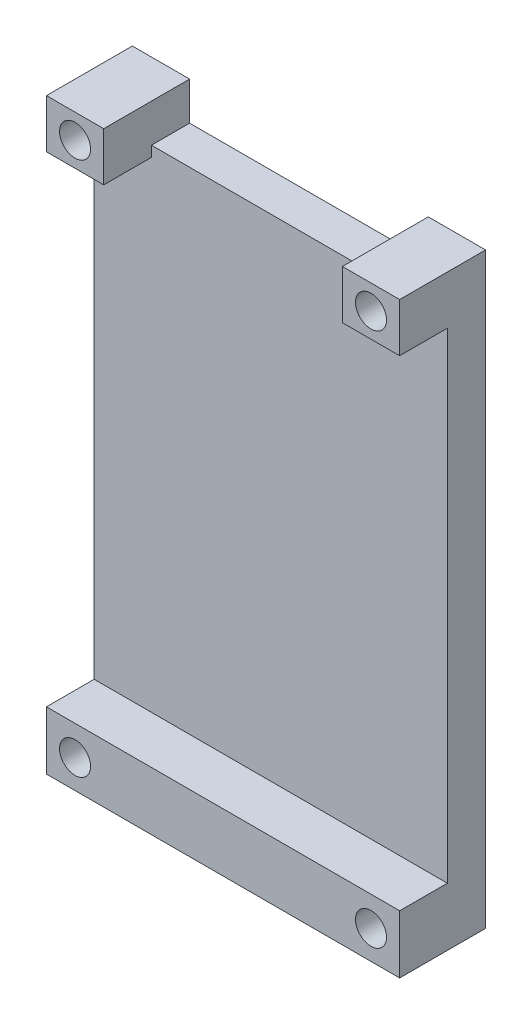
from build123d import *

# Parameters (mm, degrees)
SKETCH1_R           = 3.25
BOSS_EXTRUDE1_DEPTH = 8
SKETCH4_R           = 3.25
BOSS_EXTRUDE3_DEPTH = 10
BOSS_EXTRUDE4_DEPTH = 54
BOSS_EXTRUDE5_DEPTH = 2
BOSS_EXTRUDE6_DEPTH = 2
BOSS_EXTRUDE7_DEPTH = 2
BOSS_EXTRUDE8_DEPTH = 2
SKETCH10_W          = 74
SKETCH10_H          = 18
BOSS_EXTRUDE9_DEPTH = 2


with BuildPart() as part:
    # Sketch1 → Boss-Extrude1 (new body)
    with BuildSketch(Plane.XY):
        Polygon((-27, 52.55), (-27, 60.55), (-35, 60.55), (-35, -60.55), (-27, -60.55), (-27, -52.55), (27, -52.55), (27, -60.55), (35, -60.55), (35, 60.55), (27, 60.55), (27, 52.55), align=None)
        with Locations((31, 55.45)):
            Circle(SKETCH1_R, mode=Mode.SUBTRACT)
        with Locations((-31, 55.45)):
            Circle(SKETCH1_R, mode=Mode.SUBTRACT)
        with Locations((-31, -56.55)):
            Circle(SKETCH1_R, mode=Mode.SUBTRACT)
        with Locations((31, -56.55)):
            Circle(SKETCH1_R, mode=Mode.SUBTRACT)
    extrude(amount=BOSS_EXTRUDE1_DEPTH)

    # Sketch4 → Boss-Extrude3 (add)
    # profile 1 of 4: a face of its own
    with BuildSketch(Plane.XY.offset(8)):
        Polygon((-27, 60.55), (-35, 60.55), (-35, 50.35), (-27, 50.35), (-27, 52.55), align=None)
        with Locations((-31, 55.45)):
            Circle(SKETCH4_R, mode=Mode.SUBTRACT)
    # profile 2 of 4: a face of its own
    with BuildSketch(Plane.XY.offset(8)):
        Polygon((35, 50.35), (35, 60.55), (27, 60.55), (27, 52.55), (27, 50.35), align=None)
        with Locations((31, 55.45)):
            Circle(SKETCH4_R, mode=Mode.SUBTRACT)
    # profile 3 of 4: a face of its own
    with BuildSketch(Plane.XY.offset(8)):
        Polygon((35, -60.55), (35, -50.35), (27, -50.35), (27, -52.55), (27, -60.55), align=None)
        with Locations((31, -56.55)):
            Circle(SKETCH4_R, mode=Mode.SUBTRACT)
    # profile 4 of 4: a face of its own
    with BuildSketch(Plane.XY.offset(8)):
        Polygon((-27, -50.35), (-35, -50.35), (-35, -60.55), (-27, -60.55), (-27, -52.55), align=None)
        with Locations((-31, -56.55)):
            Circle(SKETCH4_R, mode=Mode.SUBTRACT)
    extrude(amount=BOSS_EXTRUDE3_DEPTH)

    # Sketch5 → Boss-Extrude4 (add)
    with BuildSketch(Plane(origin=(-27, 0, 0), x_dir=(0, 0, -1), z_dir=(1, 0, 0))):
        Polygon((-18, -50.35), (-8, -50.35), (-8, -52.55), (0, -52.55), (0, -60.55), (-18, -60.55), align=None)
    extrude(amount=BOSS_EXTRUDE4_DEPTH)

    # Sketch6 → Boss-Extrude5 (add)
    with BuildSketch(Plane(origin=(35, 0, 0), x_dir=(0, 0, -1), z_dir=(1, 0, 0))):
        Polygon((0, -60.55), (0, 60.55), (-18, 60.55), (-18, 50.35), (-8, 50.35), (-8, -50.35), (-18, -50.35), (-18, -60.55), align=None)
    extrude(amount=BOSS_EXTRUDE5_DEPTH)

    # Sketch7 → Boss-Extrude6 (add)
    with BuildSketch(Plane.ZY.offset(-27)):
        Polygon((0, 60.55), (0, 52.55), (8, 52.55), (8, 50.35), (18, 50.35), (18, 60.55), align=None)
    extrude(amount=BOSS_EXTRUDE6_DEPTH)

    # Sketch8 → Boss-Extrude7 (add)
    with BuildSketch(Plane.ZY.offset(35)):
        Polygon((0, 60.55), (0, -60.55), (18, -60.55), (18, -50.35), (8, -50.35), (8, 50.35), (18, 50.35), (18, 60.55), align=None)
    extrude(amount=BOSS_EXTRUDE7_DEPTH)

    # Sketch9 → Boss-Extrude8 (add)
    with BuildSketch(Plane(origin=(-27, 0, 0), x_dir=(0, 0, -1), z_dir=(1, 0, 0))):
        Polygon((0, 52.55), (0, 60.55), (-18, 60.55), (-18, 50.35), (-8, 50.35), (-8, 52.55), align=None)
    extrude(amount=BOSS_EXTRUDE8_DEPTH)

    # Sketch10 → Boss-Extrude9 (add)
    with BuildSketch(Plane.XZ.offset(60.55)):
        with Locations((0, 9)):
            Rectangle(SKETCH10_W, SKETCH10_H)
    extrude(amount=BOSS_EXTRUDE9_DEPTH)


solid = part.part
